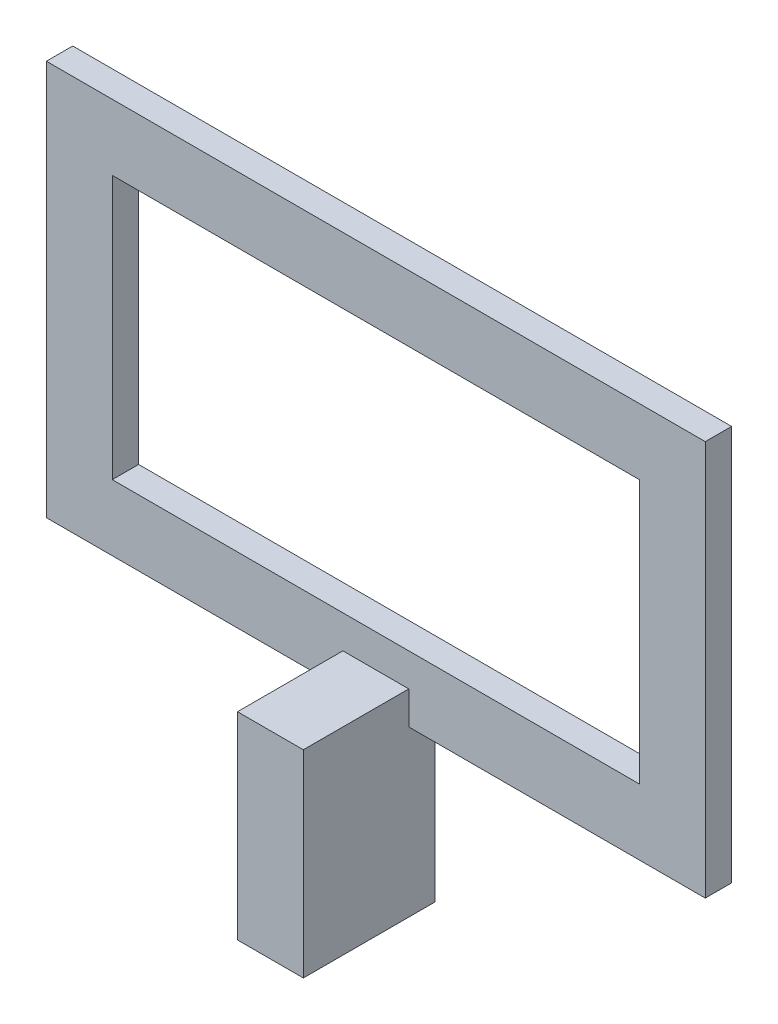
from build123d import *

# Parameters (mm, degrees)
SKETCH_1_W          = 500
SKETCH_1_H          = 300
EXTRUDE_1_DEPTH     = 20
SKETCH_2_W          = 450
SKETCH_2_H          = 250
EXTRUDE_2_DEPTH     = 10
SKETCH_3_W          = 400
SKETCH_3_H          = 200
CUT_EXTRUDE_1_DEPTH = 293.232783924
SKETCH_4_W          = 50
SKETCH_4_H          = 150
EXTRUDE_3_DEPTH     = 100


with BuildPart() as part:
    # 草图1 → 凸台-拉伸1 (new body)
    with BuildSketch(Plane.XY):
        Rectangle(SKETCH_1_W, SKETCH_1_H)
    extrude(amount=EXTRUDE_1_DEPTH)

    # 草图2 → 凸台-拉伸2 (add)
    with BuildSketch(Plane.XY):
        Rectangle(SKETCH_2_W, SKETCH_2_H)
    extrude(amount=EXTRUDE_2_DEPTH)

    # 草图3 → 切除-拉伸1 (cut, through all)
    with BuildSketch(Plane.XY):
        Rectangle(SKETCH_3_W, SKETCH_3_H)
    extrude(amount=CUT_EXTRUDE_1_DEPTH, mode=Mode.SUBTRACT)

    # 草图4 → 凸台-拉伸3 (add)
    with BuildSketch(Plane.XY):
        with Locations((0, -200)):
            Rectangle(SKETCH_4_W, SKETCH_4_H)
    extrude(amount=EXTRUDE_3_DEPTH)


solid = part.part
